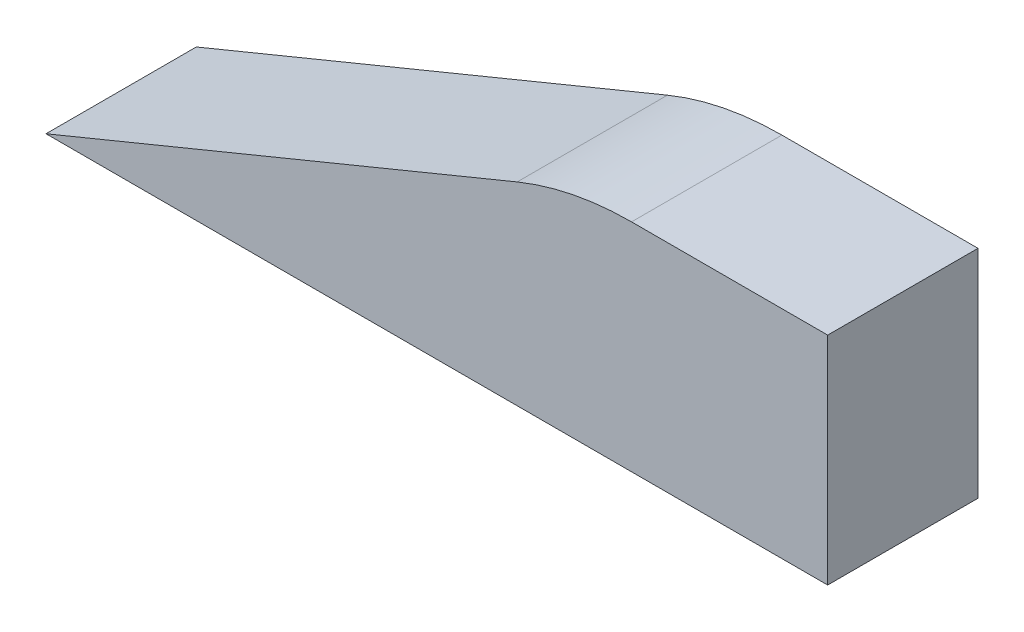
from build123d import *

# Parameters (mm, degrees)
EXTRUDE_1_DEPTH = 10
SKETCH_3_W      = 10
SKETCH_3_H      = 14.4
EXTRUDE_2_DEPTH = 17
FILLET_1_R      = 20


with BuildPart() as part:
    # 草图1 → 凸台-拉伸1 (new body)
    with BuildSketch(Plane.XY):
        Polygon((0, 0), (-35, 0), (0, 14.4), align=None)
    extrude(amount=EXTRUDE_1_DEPTH)

    # 草图3 → 凸台-拉伸2 (add)
    with BuildSketch(Plane(origin=(0, 0, 0), x_dir=(0, 0, -1), z_dir=(1, 0, 0))):
        with Locations((-5, 7.2)):
            Rectangle(SKETCH_3_W, SKETCH_3_H)
    extrude(amount=EXTRUDE_2_DEPTH)

    # 圆角1
    fillet_1_edges = [part.edges().sort_by_distance(p)[0] for p in [
        (0, 14.4, 5),
    ]]
    fillet(fillet_1_edges, radius=FILLET_1_R)


solid = part.part
